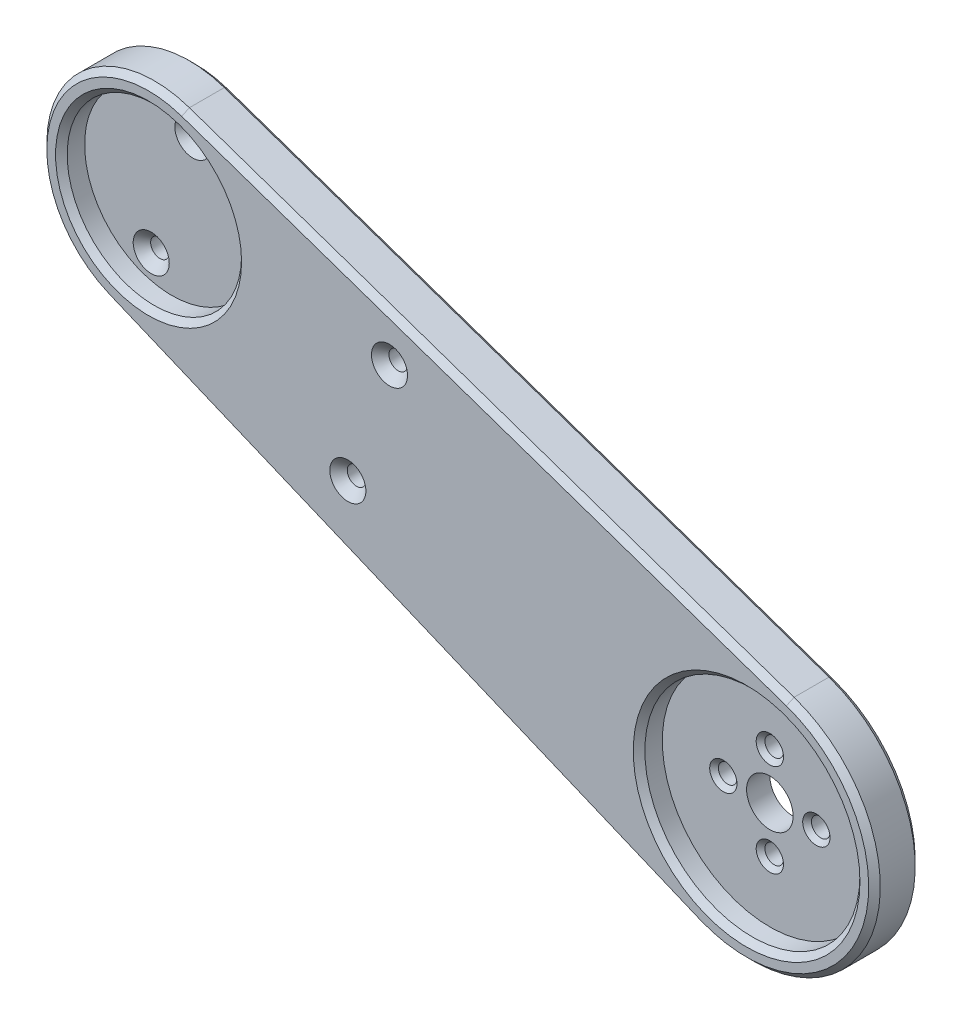
from build123d import *

# Parameters (mm, degrees)
SKETCH1_R               = 18.5
SKETCH1_R_2             = 15
BOSS_EXTRUDE1_DEPTH     = 8
SKETCH1_5_R             = 18.5
SKETCH1_5_R_2           = 1.6
SKETCH1_5_R_3           = 15
BOSS_EXTRUDE4_DEPTH     = 4
CHAMFER1_SIZE           = 0.75
CHAMFER3_SIZE           = 1
SKETCH8_R               = 4
CUT_EXTRUDE1_DEPTH      = 109.32973067
CUT_EXTRUDE2_DEPTH      = 109.32973067
CUT_EXTRUDE2_DEPTH_BACK = 109.32973067
SKETCH10_R              = 1.6
CHAMFER4_SIZE           = 1.5
CHAMFER5_SIZE           = 1


with BuildPart() as part:
    # Sketch1 → Boss-Extrude1 (new body)
    with BuildSketch(Plane.XY):
        with BuildLine():
            ThreePointArc((-72.100325672, 47.313455418), (-95.415884826, 36.399419854), (-85.248853195, 12.748564927))
            Line((-85.248853195, 12.748564927), (16.267852417, -29.611303837))
            ThreePointArc((16.267852417, -29.611303837), (45.302324024, -17.129962587), (31.903939201, 11.49289026))
            Line((31.903939201, 11.49289026), (-72.100325672, 47.313455418))
        make_face()
        with Locations((24.73982617, -9.307962715)):
            Circle(SKETCH1_R, mode=Mode.SUBTRACT)
        with Locations((-78.124693448, 29.821829053)):
            Circle(SKETCH1_R_2, mode=Mode.SUBTRACT)
    extrude(amount=BOSS_EXTRUDE1_DEPTH)

    # Sketch1<5> → Boss-Extrude4 (add)
    # profile 1 of 2: a face of its own
    with BuildSketch(Plane.XY):
        with Locations((24.73982617, -9.307962715)):
            Circle(SKETCH1_5_R)
        with Locations((24.73982617, -17.307962715)):
            Circle(SKETCH1_5_R_2, mode=Mode.SUBTRACT)
        with Locations((16.73982617, -9.307962715)):
            Circle(SKETCH1_5_R_2, mode=Mode.SUBTRACT)
        with Locations((32.73982617, -9.307962715)):
            Circle(SKETCH1_5_R_2, mode=Mode.SUBTRACT)
        with Locations((24.73982617, -1.307962715)):
            Circle(SKETCH1_5_R_2, mode=Mode.SUBTRACT)
    # profile 2 of 2: a face of its own
    with BuildSketch(Plane.XY):
        with Locations((-78.124693448, 29.821829053)):
            Circle(SKETCH1_5_R_3)
    extrude(amount=BOSS_EXTRUDE4_DEPTH)

    # Chamfer1
    chamfer1_edges = [part.edges().sort_by_distance(p)[0] for p in [
        (15.13982617, -9.307962715, 4),
        (23.13982617, -17.307962715, 4),
        (31.13982617, -9.307962715, 4),
        (23.13982617, -1.307962715, 4),
    ]]
    chamfer(chamfer1_edges, length=CHAMFER1_SIZE)

    # Chamfer3
    chamfer3_edges = [part.edges().sort_by_distance(p)[0] for p in [
        (6.23982617, -9.307962715, 8),
        (-93.124693448, 29.821829053, 8),
    ]]
    chamfer(chamfer3_edges, length=CHAMFER3_SIZE)

    # Sketch8 → Cut-Extrude1 (cut, through all)
    with BuildSketch(Plane(origin=(0, 0, 0), x_dir=(-1, 0, 0), z_dir=(0, 0, -1))):
        with Locations((-24.73982617, -9.307962715)):
            Circle(SKETCH8_R)
    extrude(amount=-CUT_EXTRUDE1_DEPTH, mode=Mode.SUBTRACT)

    # Sketch10 → Cut-Extrude2 (cut, two sides: drawn at the far end of the back side and taken through both)
    with BuildSketch(Plane(origin=(0, 0, 0), x_dir=(-1, 0, 0), z_dir=(0, 0, -1)).offset(-CUT_EXTRUDE2_DEPTH_BACK)):
        with Locations((74.502789559, 40.208531531)):
            Circle(SKETCH10_R)
        with Locations((36.683056878, 27.182871474)):
            Circle(SKETCH10_R)
        with Locations((81.66690259, 19.407678557)):
            Circle(SKETCH10_R)
        with Locations((43.847169909, 6.382018499)):
            Circle(SKETCH10_R)
    extrude(amount=CUT_EXTRUDE2_DEPTH + CUT_EXTRUDE2_DEPTH_BACK, mode=Mode.SUBTRACT)

    # Chamfer4
    chamfer4_edges = [part.edges().sort_by_distance(p)[0] for p in [
        (-72.902789559, 40.208531531, 4),
        (-42.247169909, 6.382018499, 8),
        (-35.083056878, 27.182871474, 8),
        (-80.06690259, 19.407678557, 4),
    ]]
    chamfer(chamfer4_edges, length=CHAMFER4_SIZE)

    # Chamfer5
    chamfer5_edges = [part.edges().sort_by_distance(p)[0] for p in [
        (-34.490500389, -8.431369455, 0),
        (-95.415884826, 36.399419854, 0),
        (45.302324024, -17.129962587, 0),
        (-20.098193235, 29.403172839, 0),
        (-34.490500389, -8.431369455, 8),
        (-95.415884826, 36.399419854, 8),
        (45.302324024, -17.129962587, 8),
        (-20.098193235, 29.403172839, 8),
    ]]
    chamfer(chamfer5_edges, length=CHAMFER5_SIZE)


solid = part.part
